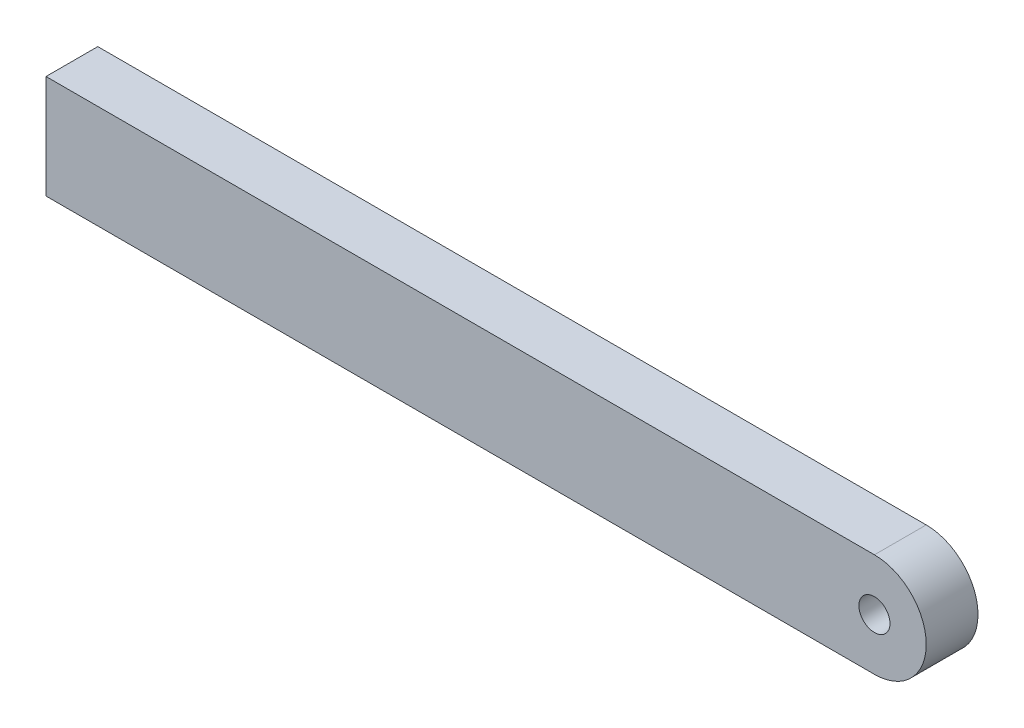
from build123d import *

# Parameters (mm, degrees)
SKETCH_1_R      = 1.5
EXTRUDE_1_DEPTH = 5


with BuildPart() as part:
    # 草图1 → 凸台-拉伸1 (new body)
    with BuildSketch(Plane.XY):
        with BuildLine():
            Line((-40, -5), (40, -5))
            ThreePointArc((40, -5), (45, 0), (40, 5))
            Line((40, 5), (-40, 5))
            Line((-40, 5), (-40, -5))
        make_face()
        with Locations((40, 0)):
            Circle(SKETCH_1_R, mode=Mode.SUBTRACT)
    extrude(amount=EXTRUDE_1_DEPTH)


solid = part.part
